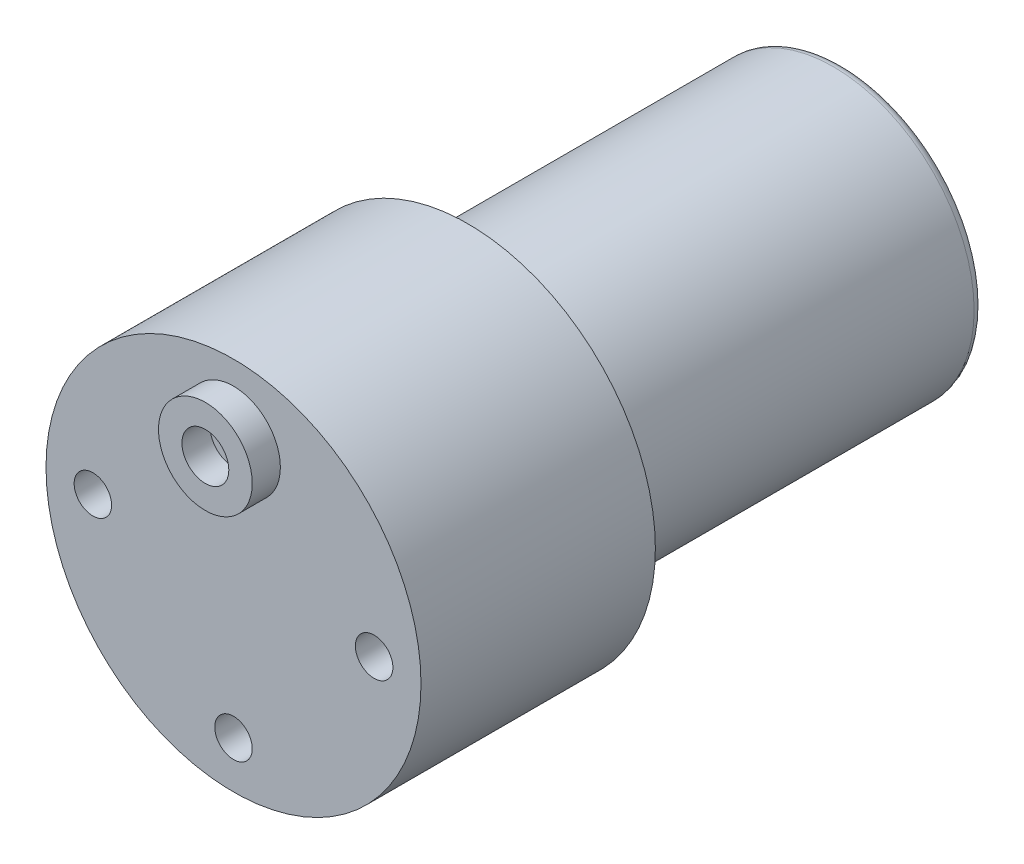
from build123d import *

# Parameters (mm, degrees)
CROQUIS1_R              = 15
SALIENTE_EXTRUIR1_DEPTH = 40
CROQUIS2_R              = 20
SALIENTE_EXTRUIR2_DEPTH = 25
CROQUIS3_R              = 0.884543568
SALIENTE_EXTRUIR3_DEPTH = 3
CROQUIS4_R              = 5
CROQUIS4_R_2            = 2.5
SALIENTE_EXTRUIR4_DEPTH = 3
CORTAR_EXTRUIR1_DEPTH   = 3
REDONDEO3_R             = 1
CROQUIS6_R              = 2
CORTAR_EXTRUIR2_DEPTH   = 10


with BuildPart() as part:
    # Croquis1 → Saliente-Extruir1 (new body)
    with BuildSketch(Plane.XY):
        Circle(CROQUIS1_R)
    extrude(amount=SALIENTE_EXTRUIR1_DEPTH)

    # Croquis2 → Saliente-Extruir2 (add)
    with BuildSketch(Plane.XY.offset(40)):
        Circle(CROQUIS2_R)
    extrude(amount=SALIENTE_EXTRUIR2_DEPTH)

    # Croquis3 → Saliente-Extruir3 (add)
    with BuildSketch(Plane(origin=(0, 0, 0), x_dir=(-1, 0, 0), z_dir=(0, 0, -1))):
        with Locations(Location((0, 0, 0), (0, 0, 180))):
            Circle(CROQUIS3_R)
    extrude(amount=SALIENTE_EXTRUIR3_DEPTH)

    # Croquis4 → Saliente-Extruir4 (add)
    with BuildSketch(Plane.XY.offset(65)):
        with Locations((0, 12.5)):
            Circle(CROQUIS4_R)
        with Locations((0, 12.5)):
            Circle(CROQUIS4_R_2, mode=Mode.SUBTRACT)
    extrude(amount=SALIENTE_EXTRUIR4_DEPTH)

    # Croquis5 → Cortar-Extruir1 (cut)
    with BuildSketch(Plane(origin=(0, 0, 0), x_dir=(-1, 0, 0), z_dir=(0, 0, -1))):
        with BuildLine():
            Line((-3.149243081, 8.006162221), (-4.211738534, 10.70729095))
            ThreePointArc((-4.211738534, 10.70729095), (-9.509061365, 6.477852492), (-11.505860288, 0))
            Line((-11.505860288, 0), (-8.60327644, 0))
            ThreePointArc((-8.60327644, 0), (-7.110210064, 4.843684378), (-3.149243081, 8.006162221))
        make_face()
        with BuildLine():
            Line((-8.063121691, -3.000405654), (-10.783467475, -4.012686155))
            ThreePointArc((-10.783467475, -4.012686155), (-6.565645996, -9.44865671), (0, -11.505860288))
            Line((0, -11.505860288), (0, -8.60327644))
            ThreePointArc((0, -8.60327644), (-4.90933021, -7.065043693), (-8.063121691, -3.000405654))
        make_face()
        with BuildLine():
            ThreePointArc((8.60327644, 0), (7.097403678, -4.862430105), (3.106945666, -8.022671259))
            Line((3.106945666, -8.022671259), (4.012686155, -10.783467475))
            ThreePointArc((4.012686155, -10.783467475), (9.44865671, -6.565645996), (11.505860288, 0))
            Line((11.505860288, 0), (8.60327644, 0))
        make_face()
        with BuildLine():
            ThreePointArc((7.897835112, 3.411827377), (4.725646591, 7.189202306), (0, 8.60327644))
            Line((0, 8.60327644), (0, 11.505860288))
            ThreePointArc((0, 11.505860288), (6.319990974, 9.614704106), (10.562416308, 4.562913838))
            Line((10.562416308, 4.562913838), (7.897835112, 3.411827377))
        make_face()
    extrude(amount=-CORTAR_EXTRUIR1_DEPTH, mode=Mode.SUBTRACT)

    # Redondeo3
    redondeo3_edges = [part.edges().sort_by_distance(p)[0] for p in [
        (-15, 0, 0),
    ]]
    fillet(redondeo3_edges, radius=REDONDEO3_R)

    # Croquis6 → Cortar-Extruir2 (cut)
    with BuildSketch(Plane.XY.offset(65)):
        with Locations((15, 0)):
            Circle(CROQUIS6_R)
        with Locations((-15, 0)):
            Circle(CROQUIS6_R)
        with Locations((0, -15)):
            Circle(CROQUIS6_R)
    extrude(amount=-CORTAR_EXTRUIR2_DEPTH, mode=Mode.SUBTRACT)


solid = part.part
